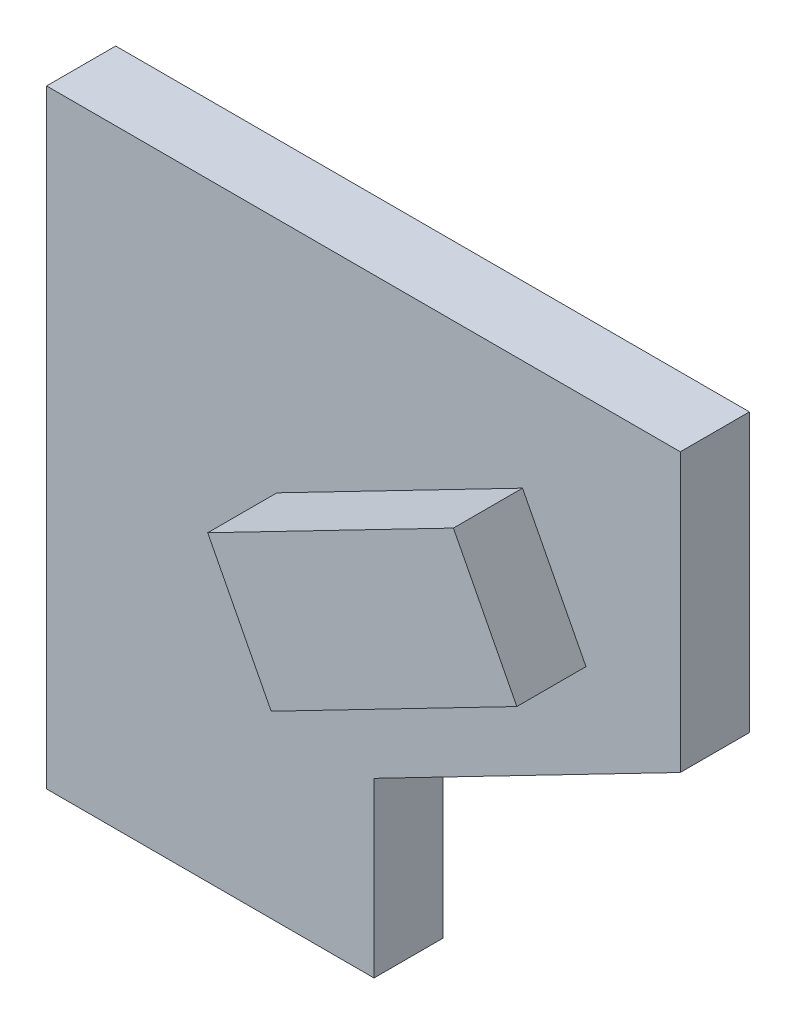
from build123d import *

# Parameters (mm, degrees)
BOSS_EXTRUDE1_DEPTH = 10
SKETCH4_W           = 40
SKETCH4_H           = 20
BOSS_EXTRUDE2_DEPTH = 10


with BuildPart() as part:
    # Sketch1 → Boss-Extrude1 (new body)
    with BuildSketch(Plane.XY):
        Polygon((-21.95277207, -30.06864538), (25.41199676, -30.06864538), (25.41199676, -5.055789931), (69.716682209, 17.828311863), (69.716682209, 58.008537106), (-21.95277207, 58.008537106), align=None)
    extrude(amount=BOSS_EXTRUDE1_DEPTH)

    # Sketch4 → Boss-Extrude2 (add)
    with BuildSketch(Plane(origin=(25.41199676, -5.055789931, 10), x_dir=(0.8884803040682522, 0.458914751650877, 0), z_dir=(0, 0, 1))):
        with Locations((20.70095496, 21.984466403)):
            Rectangle(SKETCH4_W, SKETCH4_H)
    extrude(amount=BOSS_EXTRUDE2_DEPTH)


solid = part.part
